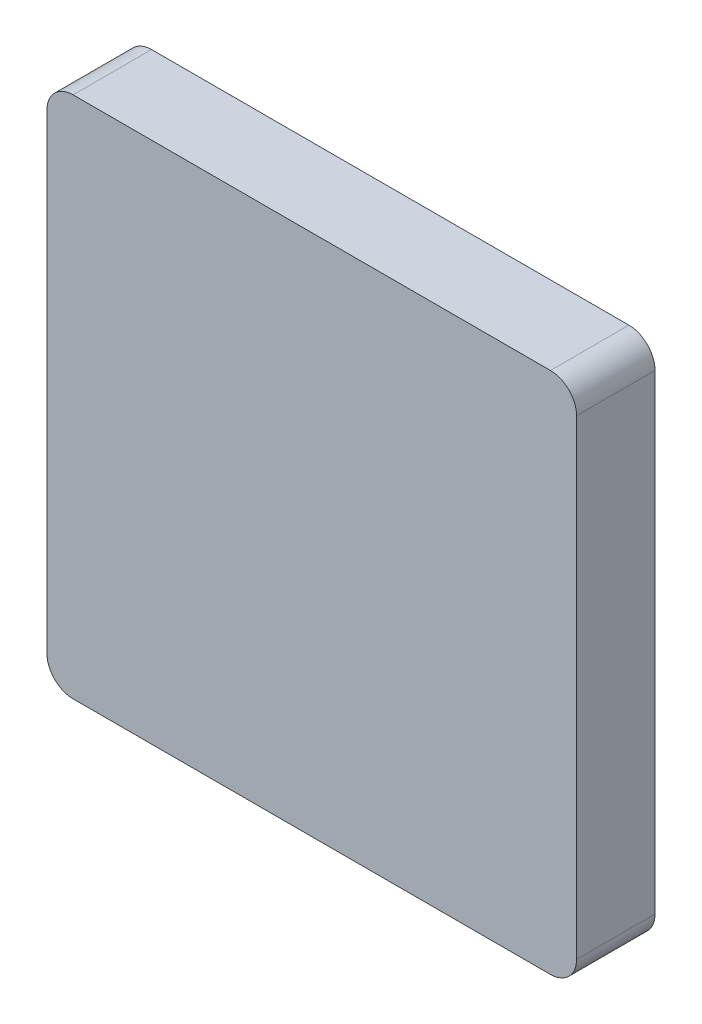
from build123d import *

# Parameters (mm, degrees)
SKETCH1_W           = 40.5
SKETCH1_H           = 40
BOSS_EXTRUDE1_DEPTH = 6
FILLET1_R           = 2


with BuildPart() as part:
    # Sketch1 → Boss-Extrude1 (new body)
    with BuildSketch(Plane.XY):
        Rectangle(SKETCH1_W, SKETCH1_H)
    extrude(amount=BOSS_EXTRUDE1_DEPTH)

    # Fillet1
    fillet1_edges = [part.edges().sort_by_distance(p)[0] for p in [
        (20.25, -20, 3),
        (-20.25, -20, 3),
        (-20.25, 20, 3),
        (20.25, 20, 3),
    ]]
    fillet(fillet1_edges, radius=FILLET1_R)


solid = part.part
